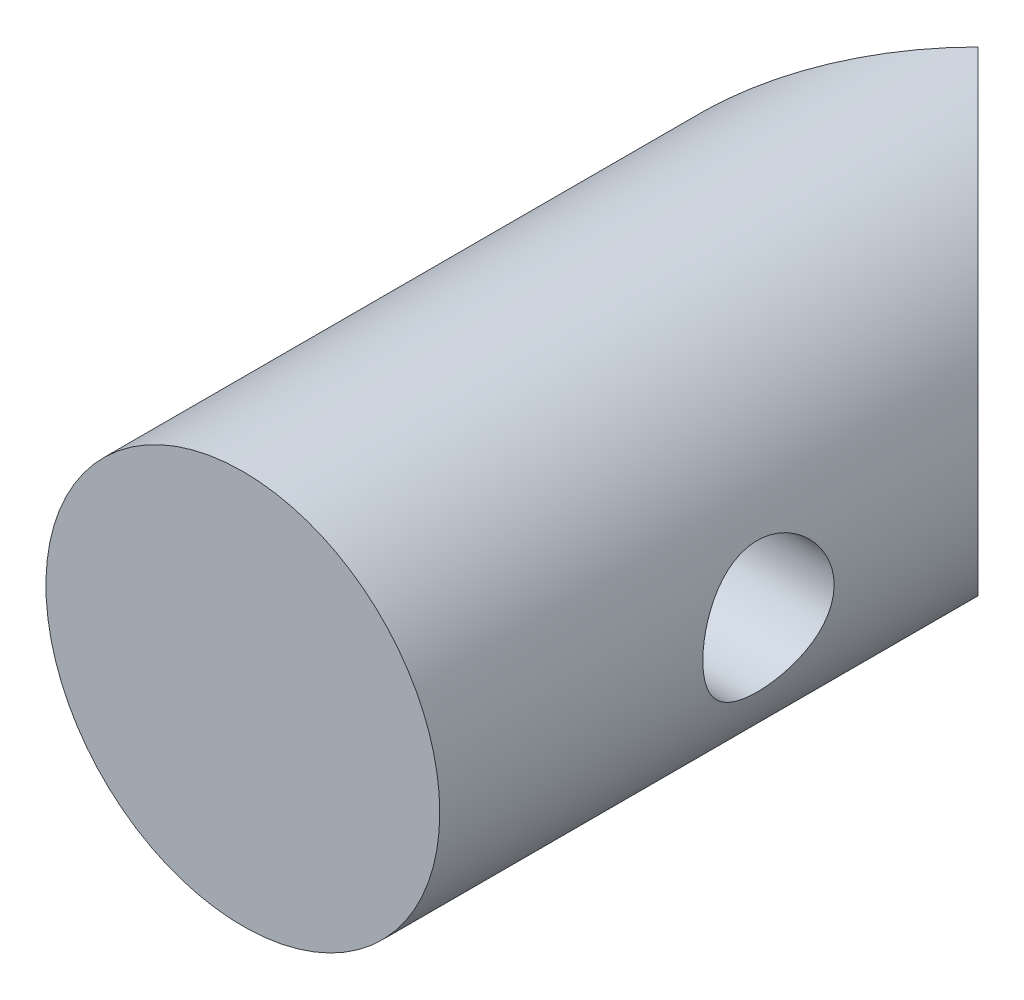
from build123d import *

# Parameters (mm, degrees)
SKETCH1_R           = 4.7625
EXTRUDE1_DEPTH      = 17.78
EXTRUDE2_DEPTH      = 20.01292225
EXTRUDE2_DEPTH_BACK = 20.01292225


with BuildPart() as part:
    # Sketch1 → Extrude1 (new body)
    with BuildSketch(Plane.XY):
        Circle(SKETCH1_R)
    extrude(amount=EXTRUDE1_DEPTH)

    # Sketch2 → Extrude2 (cut, two sides: drawn at the far end of the back side and taken through both)
    with BuildSketch(Plane(origin=(0, 0, 0), x_dir=(1, 0, 0), z_dir=(0, 1, 0)).offset(-EXTRUDE2_DEPTH_BACK)):
        Polygon((0, 0), (4.7625, -4.7625), (4.7625, 1.90519665), (-4.7625, 1.90519665), (-4.7625, -4.7625), align=None)
    extrude(amount=EXTRUDE2_DEPTH + EXTRUDE2_DEPTH_BACK, mode=Mode.SUBTRACT)

    # Sketch5 → 1/8 (0.125) Diameter Hole1 (revolve, cut)
    with BuildSketch(Plane(origin=(0, 0, 9.8298), x_dir=(0, 0, 1), z_dir=(0, 1, 0))):
        Polygon((0, 0), (0, 16.955866233), (1.5875, 16.002), (1.5875, 0), align=None)
    revolve(axis=Axis((-6.35, 0, 9.8298), (1, 0, 0)), mode=Mode.SUBTRACT)


solid = part.part
